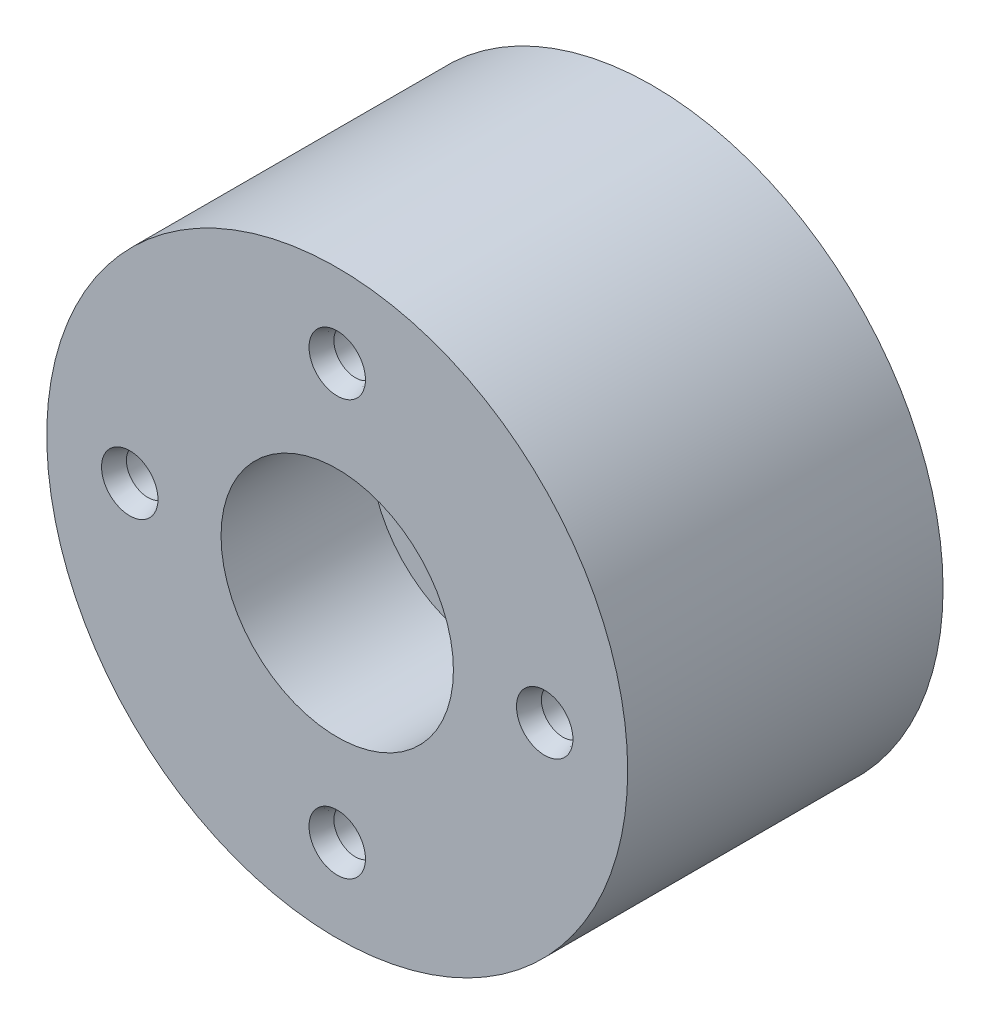
from build123d import *

# Parameters (mm, degrees)
SKETCH_1_R          = 17.5
EXTRUDE_1_DEPTH     = 19
SKETCH_2_R          = 1.3
CUT_EXTRUDE_1_DEPTH = 8
SKETCH_4_R          = 7
CUT_EXTRUDE_3_DEPTH = 9
SKETCH_5_R          = 5.55
CUT_EXTRUDE_4_DEPTH = 10
CUT_EXTRUDE_START   = -8
CUT_EXTRUDE_6_DEPTH = 8
FILLET_1_R          = 1
FILLET_2_R          = 0.5
CHAMFER_1_SIZE      = 0.9
CHAMFER_1_SIZE2     = 1.558845727
CHAMFER_2_SIZE      = 0.4
CHAMFER_2_SIZE2     = 1.098990968


with BuildPart() as part:
    # 草图1 → 凸台-拉伸1 (new body)
    with BuildSketch(Plane.XY):
        Circle(SKETCH_1_R)
    extrude(amount=-EXTRUDE_1_DEPTH)

    # 草图2 → 切除-拉伸1 (cut)
    with BuildSketch(Plane.XY):
        with Locations((12.5, 0)):
            Circle(SKETCH_2_R)
        with Locations((0, -12.5)):
            Circle(SKETCH_2_R)
        with Locations((-12.5, 0)):
            Circle(SKETCH_2_R)
        with Locations((0, 12.5)):
            Circle(SKETCH_2_R)
    extrude(amount=-CUT_EXTRUDE_1_DEPTH, mode=Mode.SUBTRACT)

    # 草图4 → 切除-拉伸3 (cut)
    with BuildSketch(Plane.XY):
        Circle(SKETCH_4_R)
    extrude(amount=-CUT_EXTRUDE_3_DEPTH, mode=Mode.SUBTRACT)

    # 草图5 → 切除-拉伸4 (cut)
    with BuildSketch(Plane.XY.offset(-9)):
        Circle(SKETCH_5_R)
    extrude(amount=-CUT_EXTRUDE_4_DEPTH, mode=Mode.SUBTRACT)

    # 草图11 → 切除-拉伸6 (cut)
    with BuildSketch(Plane(origin=(0, 0, -19), x_dir=(-1, 0, 0), z_dir=(0, 0, -1)).offset(CUT_EXTRUDE_START)):
        with BuildLine():
            ThreePointArc((17.194499347, 3.255640061), (16.671203225, 5.32174624), (15.900621658, 7.308914482))
            Line((15.900621658, 7.308914482), (7.74531425, 6.090095623))
            ThreePointArc((7.74531425, 6.090095623), (5.978780701, 3.702762547), (8.366113777, 1.936228997))
            Line((8.366113777, 1.936228997), (17.194499347, 3.255640061))
        make_face()
    extrude(amount=CUT_EXTRUDE_6_DEPTH, mode=Mode.SUBTRACT)

    # 圆角1
    fillet_1_edges = [part.edges().sort_by_distance(p)[0] for p in [
        (-11.822967954, 6.699505053, -11),
        (-5.978780701, 3.702762547, -11),
        (-12.780306562, 2.595934529, -11),
    ]]
    fillet(fillet_1_edges, radius=FILLET_1_R)

    # 圆角2
    fillet_2_edges = [part.edges().sort_by_distance(p)[0] for p in [
        (-17.194499347, 3.255640061, -15.5),
        (-16.675851852, 5.30716167, -11),
        (-15.900621658, 7.308914482, -15.5),
        (-17.137411019, 3.543888201, -11.292266818),
        (-16.027314009, 7.026749296, -11.28802798),
    ]]
    fillet(fillet_2_edges, radius=FILLET_2_R)

    # 倒角1
    chamfer_1_edges = [part.edges().sort_by_distance(p)[0] for p in [
        (-5.55, 0, -19),
    ]]
    chamfer_1_side = [part.faces().sort_by_distance(p)[0] for p in [
        (-1.349167098, -16.951419764, -19),
    ]]
    chamfer(chamfer_1_edges, length=CHAMFER_1_SIZE, length2=CHAMFER_1_SIZE2, reference=chamfer_1_side[0])

    # 倒角2
    chamfer_2_edges = [part.edges().sort_by_distance(p)[0] for p in [
        (-1.3, -12.5, 0),
        (-13.8, 0, 0),
        (-1.3, 12.5, 0),
        (11.2, 0, 0),
    ]]
    chamfer_2_side = [part.faces().sort_by_distance(p)[0] for p in [
        (-17.005025253, 0, 0),
    ]]
    chamfer(chamfer_2_edges, length=CHAMFER_2_SIZE, length2=CHAMFER_2_SIZE2, reference=chamfer_2_side[0])


solid = part.part
